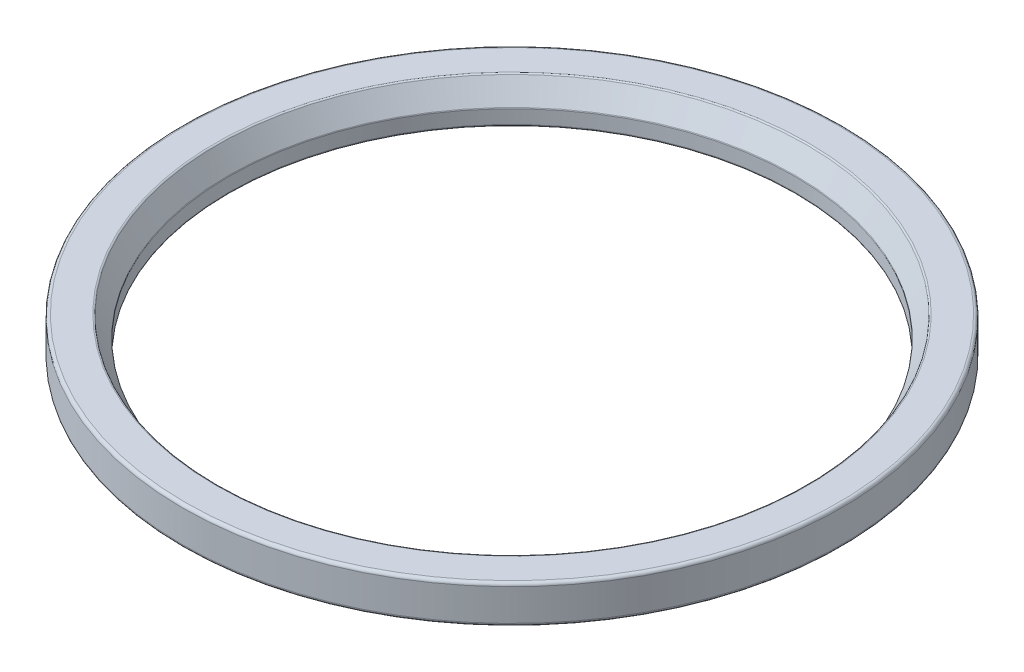
from build123d import *

# Parameters (mm, degrees)
FILETE1_R = 0.5
FILETE2_R = 0.3


with BuildPart() as part:
    # Esboço1 → Revolução1 (revolve)
    with BuildSketch(Plane.XY, mode=Mode.PRIVATE) as revolu_o1_sk:
        with BuildLine():
            Line((45.5, 6.859262227), (45.5, 9.359262227))
            Line((45.5, 9.359262227), (47.5, 12.859262227))
            Line((47.5, 12.859262227), (53, 12.859262227))
            Line((53, 12.859262227), (53, 6.859262227))
            ThreePointArc((53, 6.859262227), (49.25, 6.364636944), (45.5, 6.859262227))
        make_face()
    revolve(revolu_o1_sk.sketch.rotate(Axis((0, -41.541988481, 0), (0, 1, 0)), 90), axis=Axis((0, -41.541988481, 0), (0, 1, 0)))

    # Filete1
    filete1_edges = [part.edges().sort_by_distance(p)[0] for p in [
        (0, 12.859262227, 53),
        (0, 6.859262227, 53),
    ]]
    fillet(filete1_edges, radius=FILETE1_R)

    # Filete2
    filete2_edges = [part.edges().sort_by_distance(p)[0] for p in [
        (0, 6.859262227, 45.5),
        (0, 9.359262227, 45.5),
        (0, 12.859262227, 47.5),
    ]]
    fillet(filete2_edges, radius=FILETE2_R)


solid = part.part
